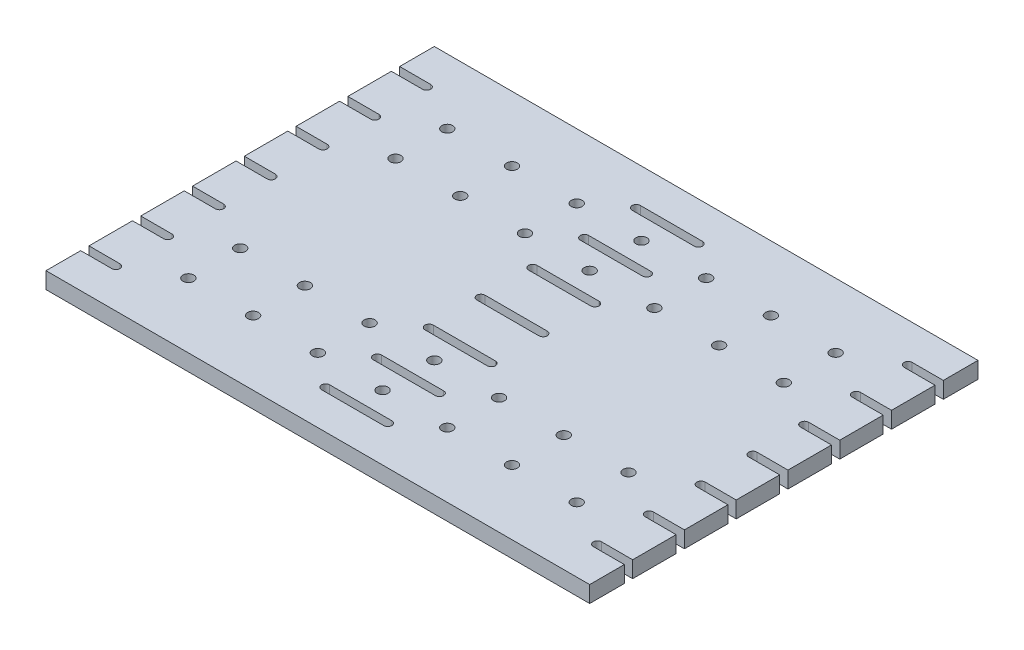
from build123d import *

# Parameters (mm, degrees)
SKETCH1_W                  = 210
SKETCH1_H                  = 150
BOSS_EXTRUDE1_DEPTH        = 6.35
CUT_EXTRUDE1_DEPTH         = 130.191031035
LPATTERN1_COUNT            = 4
LPATTERN1_PITCH            = 20
LPATTERN1_COL_COUNT        = 4
LPATTERN1_COL_PITCH        = 20
LPATTERN2_COUNT            = 2
LPATTERN2_PITCH            = 105
LPATTERN2_COPY_1_DEPTH     = 130.191031035
LPATTERN2_COPY_2_DEPTH     = 130.191031035
LPATTERN2_COPY_3_DEPTH     = 130.191031035
LPATTERN2_COPY_4_DEPTH     = 130.191031035
LPATTERN2_COPY_5_DEPTH     = 130.191031035
LPATTERN2_COPY_6_DEPTH     = 130.191031035
LPATTERN2_COL_COUNT        = 2
LPATTERN2_COL_PITCH        = 105
LPATTERN2_COL_COPY_1_DEPTH = 130.191031035
LPATTERN2_COL_COPY_2_DEPTH = 130.191031035
LPATTERN2_COL_COPY_3_DEPTH = 130.191031035
LPATTERN2_COL_COPY_4_DEPTH = 130.191031035
LPATTERN2_COL_COPY_5_DEPTH = 130.191031035
LPATTERN2_COL_COPY_6_DEPTH = 130.191031035
SKETCH4_R                  = 2.1
CUT_EXTRUDE2_DEPTH         = 130.191031035
LPATTERN3_COUNT            = 4
LPATTERN3_PITCH            = 25
LPATTERN3_COL_COUNT        = 4
LPATTERN3_COL_PITCH        = 25


with BuildPart() as part:
    # Sketch1 → Boss-Extrude1 (new body)
    with BuildSketch(Plane(origin=(0, 0, 0), x_dir=(1, 0, 0), z_dir=(0, 1, 0))):
        Rectangle(SKETCH1_W, SKETCH1_H)
    extrude(amount=BOSS_EXTRUDE1_DEPTH)

    # Sketch3 → Cut-Extrude1 (cut, symmetric)
    with BuildSketch(Plane(origin=(0, 6.35, 0), x_dir=(1, 0, 0), z_dir=(0, 1, 0))):
        with BuildLine():
            Line((12, -1.6), (-12, -1.6))
            ThreePointArc((-12, -1.6), (-13.6, 0), (-12, 1.6))
            Line((-12, 1.6), (12, 1.6))
            ThreePointArc((12, 1.6), (13.6, 0), (12, -1.6))
        make_face()
    cut_extrude1 = extrude(amount=CUT_EXTRUDE1_DEPTH, both=True, mode=Mode.SUBTRACT)

    # LPattern1: Cut-Extrude1 ×4
    with Locations(*[(0, 0, i * LPATTERN1_PITCH) for i in range(1, LPATTERN1_COUNT)]):
        add(cut_extrude1, mode=Mode.SUBTRACT)

    # LPattern1 col: Cut-Extrude1 ×4
    with Locations(*[(0, 0, -i * LPATTERN1_COL_PITCH) for i in range(1, LPATTERN1_COL_COUNT)]):
        add(cut_extrude1, mode=Mode.SUBTRACT)

    # LPattern2: Cut-Extrude1 ×2
    with Locations(*[(i * LPATTERN2_PITCH, 0, 0) for i in range(1, LPATTERN2_COUNT)]):
        add(cut_extrude1, mode=Mode.SUBTRACT)

    # LPattern2 copy 1 sketch → LPattern2 copy 1 (cut, symmetric)
    with BuildSketch(Plane(origin=(105, 6.35, 20), x_dir=(1, 0, 0), z_dir=(0, 1, 0))):
        with BuildLine():
            Line((12, -1.6), (-12, -1.6))
            ThreePointArc((-12, -1.6), (-13.6, 0), (-12, 1.6))
            Line((-12, 1.6), (12, 1.6))
            ThreePointArc((12, 1.6), (13.6, 0), (12, -1.6))
        make_face()
    extrude(amount=LPATTERN2_COPY_1_DEPTH, both=True, mode=Mode.SUBTRACT)

    # LPattern2 copy 2 sketch → LPattern2 copy 2 (cut, symmetric)
    with BuildSketch(Plane(origin=(105, 6.35, 40), x_dir=(1, 0, 0), z_dir=(0, 1, 0))):
        with BuildLine():
            Line((12, -1.6), (-12, -1.6))
            ThreePointArc((-12, -1.6), (-13.6, 0), (-12, 1.6))
            Line((-12, 1.6), (12, 1.6))
            ThreePointArc((12, 1.6), (13.6, 0), (12, -1.6))
        make_face()
    extrude(amount=LPATTERN2_COPY_2_DEPTH, both=True, mode=Mode.SUBTRACT)

    # LPattern2 copy 3 sketch → LPattern2 copy 3 (cut, symmetric)
    with BuildSketch(Plane(origin=(105, 6.35, 60), x_dir=(1, 0, 0), z_dir=(0, 1, 0))):
        with BuildLine():
            Line((12, -1.6), (-12, -1.6))
            ThreePointArc((-12, -1.6), (-13.6, 0), (-12, 1.6))
            Line((-12, 1.6), (12, 1.6))
            ThreePointArc((12, 1.6), (13.6, 0), (12, -1.6))
        make_face()
    extrude(amount=LPATTERN2_COPY_3_DEPTH, both=True, mode=Mode.SUBTRACT)

    # LPattern2 copy 4 sketch → LPattern2 copy 4 (cut, symmetric)
    with BuildSketch(Plane(origin=(105, 6.35, -20), x_dir=(1, 0, 0), z_dir=(0, 1, 0))):
        with BuildLine():
            Line((12, -1.6), (-12, -1.6))
            ThreePointArc((-12, -1.6), (-13.6, 0), (-12, 1.6))
            Line((-12, 1.6), (12, 1.6))
            ThreePointArc((12, 1.6), (13.6, 0), (12, -1.6))
        make_face()
    extrude(amount=LPATTERN2_COPY_4_DEPTH, both=True, mode=Mode.SUBTRACT)

    # LPattern2 copy 5 sketch → LPattern2 copy 5 (cut, symmetric)
    with BuildSketch(Plane(origin=(105, 6.35, -40), x_dir=(1, 0, 0), z_dir=(0, 1, 0))):
        with BuildLine():
            Line((12, -1.6), (-12, -1.6))
            ThreePointArc((-12, -1.6), (-13.6, 0), (-12, 1.6))
            Line((-12, 1.6), (12, 1.6))
            ThreePointArc((12, 1.6), (13.6, 0), (12, -1.6))
        make_face()
    extrude(amount=LPATTERN2_COPY_5_DEPTH, both=True, mode=Mode.SUBTRACT)

    # LPattern2 copy 6 sketch → LPattern2 copy 6 (cut, symmetric)
    with BuildSketch(Plane(origin=(105, 6.35, -60), x_dir=(1, 0, 0), z_dir=(0, 1, 0))):
        with BuildLine():
            Line((12, -1.6), (-12, -1.6))
            ThreePointArc((-12, -1.6), (-13.6, 0), (-12, 1.6))
            Line((-12, 1.6), (12, 1.6))
            ThreePointArc((12, 1.6), (13.6, 0), (12, -1.6))
        make_face()
    extrude(amount=LPATTERN2_COPY_6_DEPTH, both=True, mode=Mode.SUBTRACT)

    # LPattern2 col: Cut-Extrude1 ×2
    with Locations(*[(-i * LPATTERN2_COL_PITCH, 0, 0) for i in range(1, LPATTERN2_COL_COUNT)]):
        add(cut_extrude1, mode=Mode.SUBTRACT)

    # LPattern2 col copy 1 sketch → LPattern2 col copy 1 (cut, symmetric)
    with BuildSketch(Plane(origin=(-105, 6.35, 20), x_dir=(1, 0, 0), z_dir=(0, 1, 0))):
        with BuildLine():
            Line((12, -1.6), (-12, -1.6))
            ThreePointArc((-12, -1.6), (-13.6, 0), (-12, 1.6))
            Line((-12, 1.6), (12, 1.6))
            ThreePointArc((12, 1.6), (13.6, 0), (12, -1.6))
        make_face()
    extrude(amount=LPATTERN2_COL_COPY_1_DEPTH, both=True, mode=Mode.SUBTRACT)

    # LPattern2 col copy 2 sketch → LPattern2 col copy 2 (cut, symmetric)
    with BuildSketch(Plane(origin=(-105, 6.35, 40), x_dir=(1, 0, 0), z_dir=(0, 1, 0))):
        with BuildLine():
            Line((12, -1.6), (-12, -1.6))
            ThreePointArc((-12, -1.6), (-13.6, 0), (-12, 1.6))
            Line((-12, 1.6), (12, 1.6))
            ThreePointArc((12, 1.6), (13.6, 0), (12, -1.6))
        make_face()
    extrude(amount=LPATTERN2_COL_COPY_2_DEPTH, both=True, mode=Mode.SUBTRACT)

    # LPattern2 col copy 3 sketch → LPattern2 col copy 3 (cut, symmetric)
    with BuildSketch(Plane(origin=(-105, 6.35, 60), x_dir=(1, 0, 0), z_dir=(0, 1, 0))):
        with BuildLine():
            Line((12, -1.6), (-12, -1.6))
            ThreePointArc((-12, -1.6), (-13.6, 0), (-12, 1.6))
            Line((-12, 1.6), (12, 1.6))
            ThreePointArc((12, 1.6), (13.6, 0), (12, -1.6))
        make_face()
    extrude(amount=LPATTERN2_COL_COPY_3_DEPTH, both=True, mode=Mode.SUBTRACT)

    # LPattern2 col copy 4 sketch → LPattern2 col copy 4 (cut, symmetric)
    with BuildSketch(Plane(origin=(-105, 6.35, -20), x_dir=(1, 0, 0), z_dir=(0, 1, 0))):
        with BuildLine():
            Line((12, -1.6), (-12, -1.6))
            ThreePointArc((-12, -1.6), (-13.6, 0), (-12, 1.6))
            Line((-12, 1.6), (12, 1.6))
            ThreePointArc((12, 1.6), (13.6, 0), (12, -1.6))
        make_face()
    extrude(amount=LPATTERN2_COL_COPY_4_DEPTH, both=True, mode=Mode.SUBTRACT)

    # LPattern2 col copy 5 sketch → LPattern2 col copy 5 (cut, symmetric)
    with BuildSketch(Plane(origin=(-105, 6.35, -40), x_dir=(1, 0, 0), z_dir=(0, 1, 0))):
        with BuildLine():
            Line((12, -1.6), (-12, -1.6))
            ThreePointArc((-12, -1.6), (-13.6, 0), (-12, 1.6))
            Line((-12, 1.6), (12, 1.6))
            ThreePointArc((12, 1.6), (13.6, 0), (12, -1.6))
        make_face()
    extrude(amount=LPATTERN2_COL_COPY_5_DEPTH, both=True, mode=Mode.SUBTRACT)

    # LPattern2 col copy 6 sketch → LPattern2 col copy 6 (cut, symmetric)
    with BuildSketch(Plane(origin=(-105, 6.35, -60), x_dir=(1, 0, 0), z_dir=(0, 1, 0))):
        with BuildLine():
            Line((12, -1.6), (-12, -1.6))
            ThreePointArc((-12, -1.6), (-13.6, 0), (-12, 1.6))
            Line((-12, 1.6), (12, 1.6))
            ThreePointArc((12, 1.6), (13.6, 0), (12, -1.6))
        make_face()
    extrude(amount=LPATTERN2_COL_COPY_6_DEPTH, both=True, mode=Mode.SUBTRACT)

    # Sketch4 → Cut-Extrude2 (cut, symmetric)
    with BuildSketch(Plane(origin=(0, 6.35, 0), x_dir=(1, 0, 0), z_dir=(0, 1, 0))):
        with Locations(Location((0, 30, 0), (0, 0, 270))):
            Circle(SKETCH4_R)
        with Locations(Location((0, -30, 0), (0, 0, 270))):
            Circle(SKETCH4_R)
        with Locations(Location((0, 50, 0), (0, 0, 270))):
            Circle(SKETCH4_R)
        with Locations(Location((0, -50, 0), (0, 0, 270))):
            Circle(SKETCH4_R)
    cut_extrude2 = extrude(amount=CUT_EXTRUDE2_DEPTH, both=True, mode=Mode.SUBTRACT)

    # LPattern3: Cut-Extrude2 ×4
    with Locations(*[(i * LPATTERN3_PITCH, 0, 0) for i in range(1, LPATTERN3_COUNT)]):
        add(cut_extrude2, mode=Mode.SUBTRACT)

    # LPattern3 col: Cut-Extrude2 ×4
    with Locations(*[(-i * LPATTERN3_COL_PITCH, 0, 0) for i in range(1, LPATTERN3_COL_COUNT)]):
        add(cut_extrude2, mode=Mode.SUBTRACT)


solid = part.part
